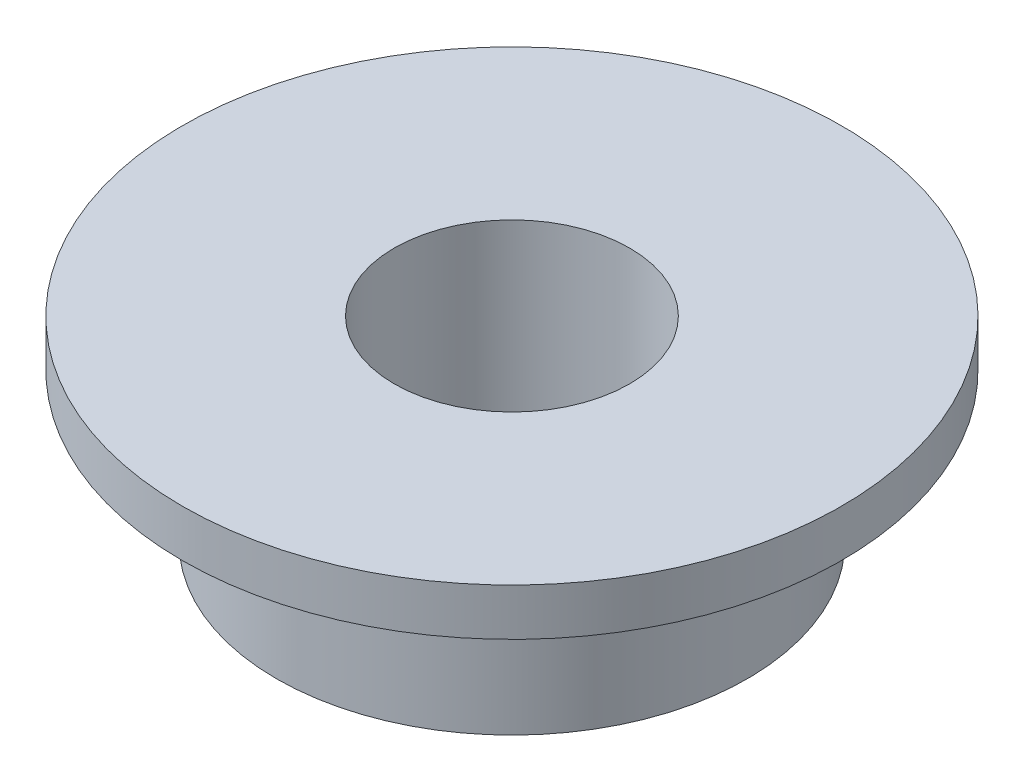
from build123d import *

# Parameters (mm, degrees)
SKETCH1_R           = 5
SKETCH1_R_2         = 2.5
BOSS_EXTRUDE1_DEPTH = 3.175
BOSS_EXTRUDE2_START = 1
SKETCH1_3_R         = 7
SKETCH1_3_R_2       = 2.5
BOSS_EXTRUDE2_DEPTH = 1


with BuildPart() as part:
    # Sketch1 → Boss-Extrude1 (new body)
    with BuildSketch(Plane(origin=(0, 0, 0), x_dir=(1, 0, 0), z_dir=(0, 1, 0))):
        Circle(SKETCH1_R)
        Circle(SKETCH1_R_2, mode=Mode.SUBTRACT)
    extrude(amount=-BOSS_EXTRUDE1_DEPTH)

    # Sketch1<3> → Boss-Extrude2 (add)
    with BuildSketch(Plane(origin=(0, 0, 0), x_dir=(1, 0, 0), z_dir=(0, 1, 0)).offset(BOSS_EXTRUDE2_START)):
        Circle(SKETCH1_3_R)
        Circle(SKETCH1_3_R_2, mode=Mode.SUBTRACT)
    extrude(amount=-BOSS_EXTRUDE2_DEPTH)


solid = part.part
